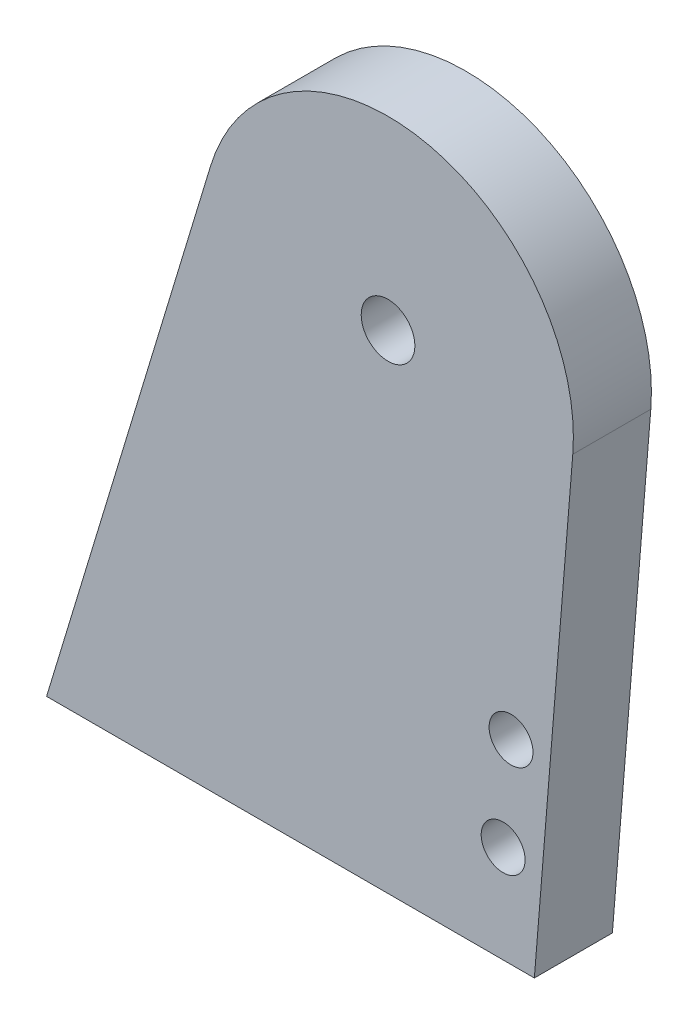
from build123d import *

# Parameters (mm, degrees)
EXTRUDE_1_DEPTH              = 8
HOLE_WIZARD_M4_1_D           = 4.5
HOLE_WIZARD_M3_1_D           = 2.5
HOLE_WIZARD_M3_1_DEPTH       = 8.5
HOLE_WIZARD_M3_1_CSINK_D     = 3.05
HOLE_WIZARD_M3_1_CSINK_ANGLE = 90
HOLE_WIZARD_M3_1_TIP         = 0.751075774
HOLE_WIZARD_M5_1_D           = 5.5


with BuildPart() as part:
    # 스케치1 → 보스-돌출1 (new body)
    with BuildSketch(Plane.XY):
        with BuildLine():
            Line((16.816107383, 55.508724832), (0, 0))
            Line((0, 0), (50, 0))
            Line((50, 0), (53.937590447, 48.461277134))
            ThreePointArc((53.937590447, 48.461277134), (31.456182162, 31.333416083), (16.816107383, 55.508724832))
        make_face()
        with BuildLine():
            ThreePointArc((54, 50), (37.784424561, 68.794865785), (16.816107383, 55.508724832))
            ThreePointArc((16.816107383, 55.508724832), (31.456182162, 31.333416083), (53.937590447, 48.461277134))
            ThreePointArc((53.937590447, 48.461277134), (53.9843912, 49.230006005), (54, 50))
        make_face()
    extrude(amount=EXTRUDE_1_DEPTH)

    # M4 여유 구멍1 (through all)
    with Locations(Plane.XY.offset(8)):
        with Locations((46.799340892, 10), (47.609195032, 19.967152867)):
            Hole(HOLE_WIZARD_M4_1_D / 2)

    # M3 나사 구멍1
    with Locations(Plane(origin=(0, 0, 0), x_dir=(-1, 0, 0), z_dir=(0, -1, 0))):
        with Locations((-10, -4), (-40, -4)):
            CounterSinkHole(HOLE_WIZARD_M3_1_D / 2, HOLE_WIZARD_M3_1_CSINK_D / 2, depth=HOLE_WIZARD_M3_1_DEPTH, counter_sink_angle=HOLE_WIZARD_M3_1_CSINK_ANGLE)
            with Locations((0, 0, -(HOLE_WIZARD_M3_1_DEPTH + HOLE_WIZARD_M3_1_TIP / 2))):  # 118° drill point
                Cone(0, HOLE_WIZARD_M3_1_D / 2, HOLE_WIZARD_M3_1_TIP, mode=Mode.SUBTRACT)

    # M5 여유 구멍1 (through all)
    with Locations(Plane(origin=(0, 0, 0), x_dir=(-1, 0, 0), z_dir=(0, 0, -1))):
        with Locations((-35, 50)):
            Hole(HOLE_WIZARD_M5_1_D / 2)


solid = part.part
